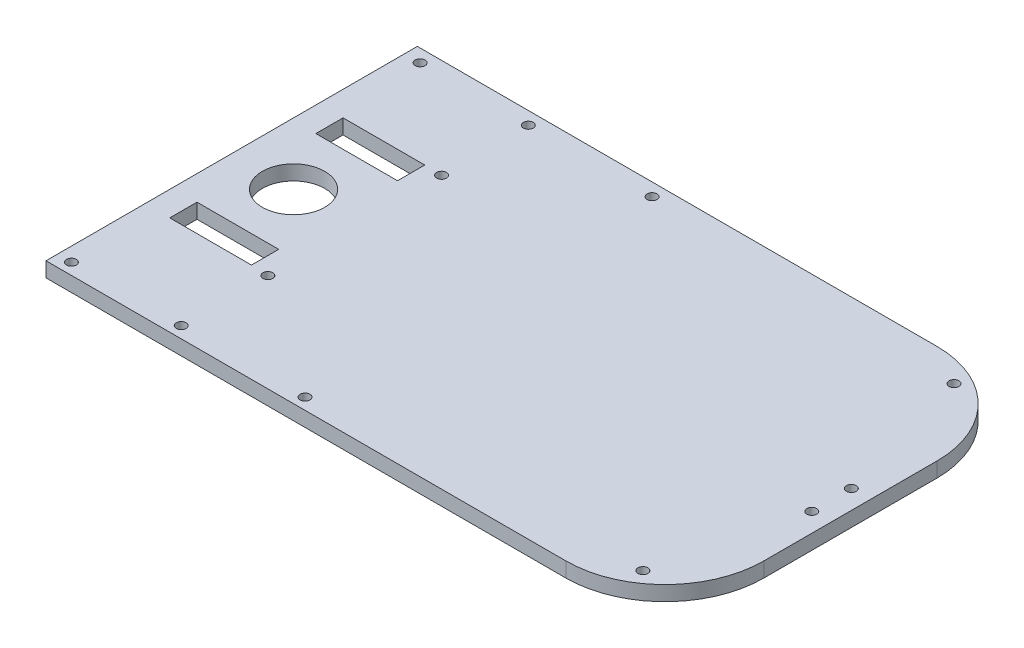
from build123d import *

# Parameters (mm, degrees)
BOSS_EXTRUDE1_DEPTH = 6
SKETCH2_R           = 12.59794853
CUT_EXTRUDE1_DEPTH  = 292.609327697
SKETCH3_R           = 2
CUT_EXTRUDE10_DEPTH = 292.609327697
SKETCH4_R           = 2
CUT_EXTRUDE11_DEPTH = 292.609327697
SKETCH5_R           = 2
CUT_EXTRUDE12_DEPTH = 292.609327697
SKETCH6_R           = 2
CUT_EXTRUDE13_DEPTH = 292.609327697
SKETCH8_R           = 2
CUT_EXTRUDE14_DEPTH = 292.609327697
SKETCH10_R          = 2
CUT_EXTRUDE15_DEPTH = 292.609327697
SKETCH13_W          = 33
SKETCH13_H          = 11
CUT_EXTRUDE16_DEPTH = 292.609327697


with BuildPart() as part:
    # Sketch1 → Boss-Extrude1 (new body)
    with BuildSketch(Plane(origin=(0, 0, 0), x_dir=(1, 0, 0), z_dir=(0, 1, 0))):
        with BuildLine():
            Line((0, 0), (210, 0))
            ThreePointArc((210, 0), (238.284271247, 11.715728753), (250, 40))
            Line((250, 40), (250, 110))
            ThreePointArc((250, 110), (238.284271247, 138.284271247), (210, 150))
            Line((210, 150), (0, 150))
            Line((0, 150), (0, 0))
        make_face()
    extrude(amount=BOSS_EXTRUDE1_DEPTH)

    # Sketch2 → Cut-Extrude1 (cut, through all)
    with BuildSketch(Plane.XZ):
        with Locations(Location((25, -75, 0), (0, 0, 270))):
            Circle(SKETCH2_R)
    extrude(amount=-CUT_EXTRUDE1_DEPTH, mode=Mode.SUBTRACT)

    # Sketch3 → Cut-Extrude10 (cut, through all)
    with BuildSketch(Plane(origin=(0, 6, 0), x_dir=(1, 0, 0), z_dir=(0, 1, 0))):
        with Locations(Location((6.310878228, 144.817130454, 0), (0, 0, 270))):
            Circle(SKETCH3_R)
    extrude(amount=-CUT_EXTRUDE10_DEPTH, mode=Mode.SUBTRACT)

    # Sketch4 → Cut-Extrude11 (cut, through all)
    with BuildSketch(Plane(origin=(0, 6, 0), x_dir=(1, 0, 0), z_dir=(0, 1, 0))):
        with Locations(Location((5.635720357, 4.632829204, 0), (0, 0, 270))):
            Circle(SKETCH4_R)
    extrude(amount=-CUT_EXTRUDE11_DEPTH, mode=Mode.SUBTRACT)

    # Sketch5 → Cut-Extrude12 (cut, through all)
    with BuildSketch(Plane(origin=(0, 6, 0), x_dir=(1, 0, 0), z_dir=(0, 1, 0))):
        with Locations(Location((226.364130141, 140.421237055, 0), (0, 0, 270))):
            Circle(SKETCH5_R)
    extrude(amount=-CUT_EXTRUDE12_DEPTH, mode=Mode.SUBTRACT)

    # Sketch6 → Cut-Extrude13 (cut, through all)
    with BuildSketch(Plane(origin=(0, 6, 0), x_dir=(1, 0, 0), z_dir=(0, 1, 0))):
        with Locations(Location((228.949949788, 12.164582591, 0), (0, 0, 270))):
            Circle(SKETCH6_R)
    extrude(amount=-CUT_EXTRUDE13_DEPTH, mode=Mode.SUBTRACT)

    # Sketch8 → Cut-Extrude14 (cut, through all)
    with BuildSketch(Plane(origin=(0, 6, 0), x_dir=(1, 0, 0), z_dir=(0, 1, 0))):
        with Locations(Location((242.339859996, 83, 0), (0, 0, 270))):
            Circle(SKETCH8_R)
        with Locations(Location((242.339859996, 67, 0), (0, 0, 270))):
            Circle(SKETCH8_R)
    extrude(amount=-CUT_EXTRUDE14_DEPTH, mode=Mode.SUBTRACT)

    # Sketch10 → Cut-Extrude15 (cut, through all)
    with BuildSketch(Plane(origin=(0, 6, 0), x_dir=(1, 0, 0), z_dir=(0, 1, 0))):
        with Locations(Location((50, 144.82, 0), (0, 0, 270))):
            Circle(SKETCH10_R)
        with Locations(Location((50, 4.63, 0), (0, 0, 270))):
            Circle(SKETCH10_R)
        with Locations(Location((100, 4.63, 0), (0, 0, 270))):
            Circle(SKETCH10_R)
        with Locations(Location((100, 144.82, 0), (0, 0, 270))):
            Circle(SKETCH10_R)
        with Locations(Location((50, 109.82, 0), (0, 0, 270))):
            Circle(SKETCH10_R)
        with Locations(Location((50, 39.63, 0), (0, 0, 270))):
            Circle(SKETCH10_R)
    extrude(amount=-CUT_EXTRUDE15_DEPTH, mode=Mode.SUBTRACT)

    # Sketch13 → Cut-Extrude16 (cut, through all)
    with BuildSketch(Plane(origin=(0, 6, 0), x_dir=(1, 0, 0), z_dir=(0, 1, 0))):
        with Locations((26.5, 104.5)):
            Rectangle(SKETCH13_W, SKETCH13_H)
        with Locations((26.5, 45.5)):
            Rectangle(SKETCH13_W, SKETCH13_H)
    extrude(amount=-CUT_EXTRUDE16_DEPTH, mode=Mode.SUBTRACT)


solid = part.part
